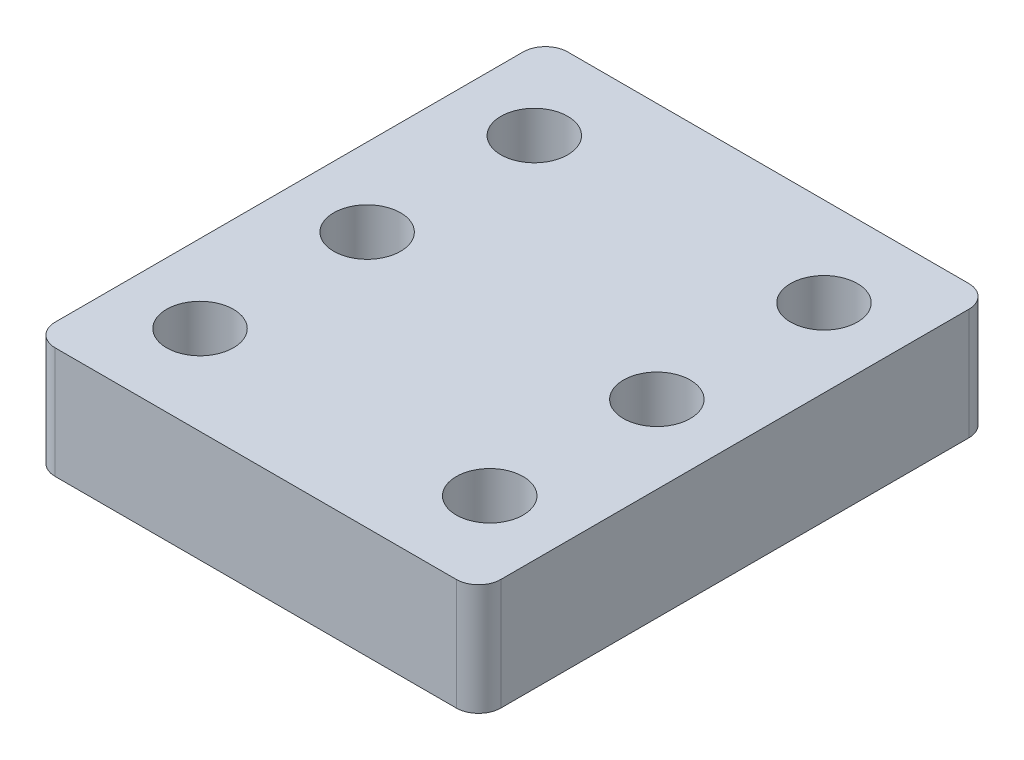
from build123d import *

# Parameters (mm, degrees)
SKETCH_1_W      = 20
SKETCH_1_H      = 23
SKETCH_1_R      = 1.5
EXTRUDE_1_DEPTH = 5
FILLET_1_R      = 1


with BuildPart() as part:
    # 草图1 → 凸台-拉伸1 (new body)
    with BuildSketch(Plane(origin=(0, 0, 0), x_dir=(1, 0, 0), z_dir=(0, 1, 0))):
        Rectangle(SKETCH_1_W, SKETCH_1_H)
        with Locations(Location((-6.5, 0, 0), (0, 0, 270))):
            Circle(SKETCH_1_R, mode=Mode.SUBTRACT)
        with Locations(Location((-6.5, -7.5, 0), (0, 0, 270))):
            Circle(SKETCH_1_R, mode=Mode.SUBTRACT)
        with Locations(Location((-6.5, 7.5, 0), (0, 0, 90))):
            Circle(SKETCH_1_R, mode=Mode.SUBTRACT)
        with Locations(Location((6.5, 7.5, 0), (0, 0, 270))):
            Circle(SKETCH_1_R, mode=Mode.SUBTRACT)
        with Locations(Location((6.5, -7.5, 0), (0, 0, 90))):
            Circle(SKETCH_1_R, mode=Mode.SUBTRACT)
        with Locations(Location((6.5, 0, 0), (0, 0, 90))):
            Circle(SKETCH_1_R, mode=Mode.SUBTRACT)
    extrude(amount=EXTRUDE_1_DEPTH)

    # 圆角1
    fillet_1_edges = [part.edges().sort_by_distance(p)[0] for p in [
        (10, 2.5, 11.5),
        (-10, 2.5, 11.5),
        (-10, 2.5, -11.5),
        (10, 2.5, -11.5),
    ]]
    fillet(fillet_1_edges, radius=FILLET_1_R)


solid = part.part
